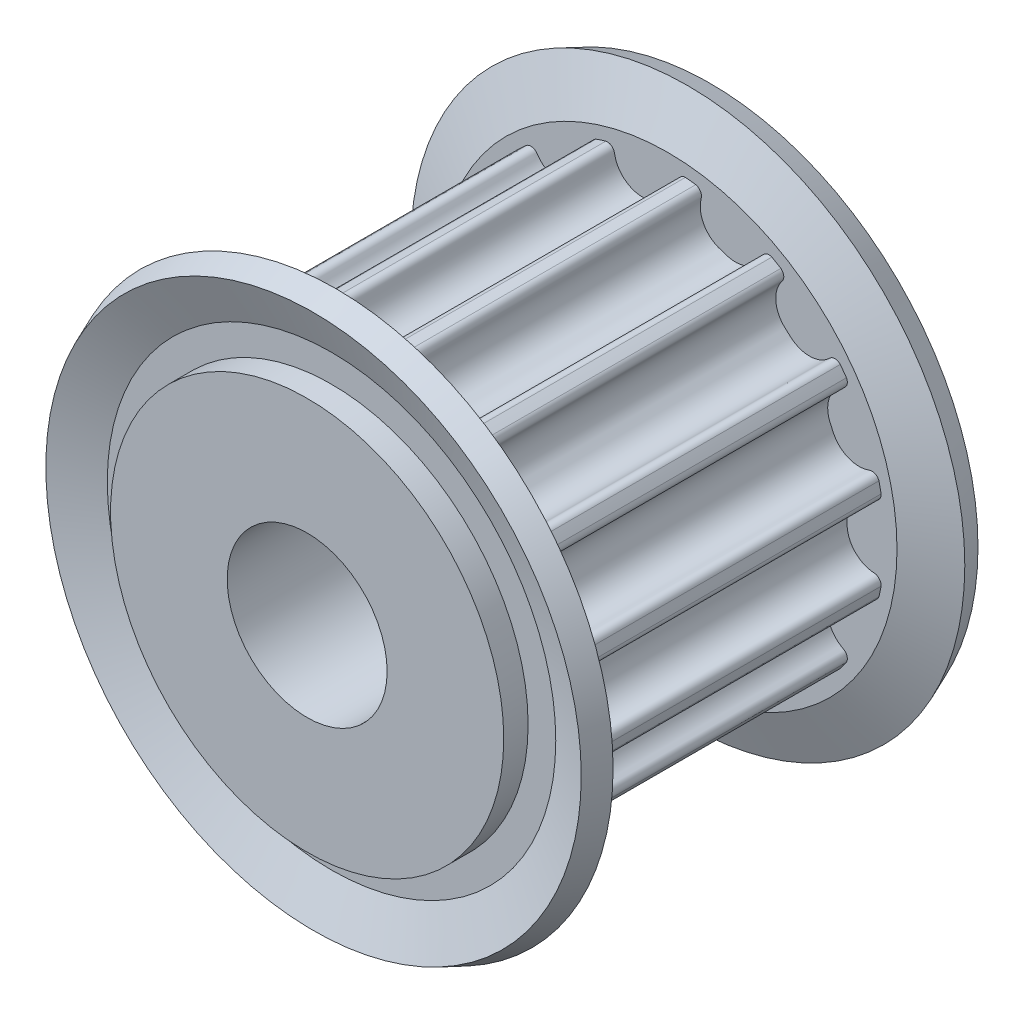
from build123d import *

# Parameters (mm, degrees)
TOOTHEXTRUDECUTGEARBELT01_DEPTH = 4.876799927
PATTERNGEARBELT01_COUNT         = 15
BOREREVOLVESKETCH_W             = 12.801599808
BOREREVOLVESKETCH_H             = 2.5


with BuildPart() as part:
    # SketchRevolveGearBelt01 → GearBelt01 (revolve)
    with BuildSketch(Plane(origin=(0, 0, 0), x_dir=(0, 0, -1), z_dir=(1, 0, 0))):
        Polygon((6.400799904, 0), (6.400799904, 6.145458216), (5.638799915, 6.145458216), (5.638799915, 7.009886979), (6.201536555, 8.368453407), (5.497540362, 8.660058178), (4.876799927, 7.161458201), (4.876799927, 6.780458207), (-4.876799927, 6.780458207), (-4.876799927, 7.161458201), (-5.497540362, 8.660058178), (-6.201536555, 8.368453407), (-5.638799915, 7.009886979), (-5.638799915, 6.145458216), (-6.400799904, 6.145458216), (-6.400799904, 0), align=None)
    revolve(axis=Axis((0, 0, 0), (0, 0, -1)))

    # SketchToothGearBelt01 → ToothExtrudeCutGearBelt01 (cut, symmetric)
    with BuildSketch(Plane.XY):
        with BuildLine():
            ThreePointArc((6.661096355, 1.272831888), (6.78161527, 0), (6.661096355, -1.272831888))
            add(Edge.make_bspline(
                [(6.661096355, -1.272831888), (6.663615018, -1.259659662), (6.665647801, -1.239568599), (6.664820876, -1.212733988), (6.662437583, -1.192740045), (6.658309361, -1.173032278), (6.652468102, -1.15376267), (6.644958835, -1.135079815), (6.635839471, -1.117127785), (6.625180333, -1.100045019), (6.613063619, -1.083963244), (6.599582765, -1.06900649), (6.584841733, -1.055290043), (6.568954182, -1.042919864), (6.552042687, -1.031990656), (6.534237438, -1.022589264), (6.515676569, -1.014778616), (6.49650012, -1.00865466), (6.476867505, -1.00413133), (6.427750984, -0.998255219), (6.361870769, -0.993498048), (6.280955314, -0.976758348), (6.213857662, -0.957771629), (6.148468462, -0.93346319), (6.085179943, -0.904141421), (6.024383488, -0.869943856), (5.966451939, -0.831092016), (5.9117414, -0.787821543), (5.860587957, -0.740399103), (5.813305895, -0.689115832), (5.770185727, -0.634286865), (5.731492294, -0.576249049), (5.697463629, -0.515358957), (5.668307661, -0.451990704), (5.644207759, -0.386533555), (5.625296172, -0.319389892), (5.611748114, -0.250971402), (5.603426544, -0.18170154), (5.601350103, -0.116556682), (5.601805881, -0.056000917), (5.601665396, 0), (5.601805881, 0.056000917), (5.601350103, 0.116556682), (5.603426544, 0.18170154), (5.611748114, 0.250971402), (5.625296172, 0.319389892), (5.644207759, 0.386533555), (5.668307661, 0.451990704), (5.697463629, 0.515358957), (5.731492294, 0.576249049), (5.770185727, 0.634286865), (5.813305895, 0.689115832), (5.860587957, 0.740399103), (5.9117414, 0.787821543), (5.966451939, 0.831092016), (6.024383488, 0.869943856), (6.085179943, 0.904141421), (6.148468462, 0.93346319), (6.213857662, 0.957771629), (6.280955314, 0.976758348), (6.361870769, 0.993498048), (6.427750984, 0.998255219), (6.476867505, 1.00413133), (6.49650012, 1.00865466), (6.515676569, 1.014778616), (6.534237438, 1.022589264), (6.552042687, 1.031990656), (6.568954182, 1.042919864), (6.584841733, 1.055290043), (6.599582765, 1.06900649), (6.613063619, 1.083963244), (6.625180333, 1.100045019), (6.635839471, 1.117127785), (6.644958835, 1.135079815), (6.652468102, 1.15376267), (6.658309361, 1.173032278), (6.662437583, 1.192740045), (6.664820876, 1.212733988), (6.665647801, 1.239568599), (6.663615018, 1.259659662), (6.661096355, 1.272831888)],
                knots=[0, 0, 0, 0, 0.010832325, 0.016248488, 0.021664651, 0.027080813, 0.032496976, 0.037913139, 0.043329302, 0.048745464, 0.054161627, 0.05957779, 0.064993952, 0.070410115, 0.075826278, 0.08124244, 0.086658603, 0.092074766, 0.097490929, 0.102907091, 0.132017291, 0.150784932, 0.169552572, 0.188320213, 0.207087853, 0.225855493, 0.244623134, 0.263390774, 0.282158415, 0.300926055, 0.319693695, 0.338461336, 0.357228976, 0.375996617, 0.394764257, 0.413531897, 0.432299538, 0.451067178, 0.469834819, 0.484917409, 0.5, 0.515082591, 0.530165181, 0.548932822, 0.567700462, 0.586468103, 0.605235743, 0.624003383, 0.642771024, 0.661538664, 0.680306305, 0.699073945, 0.717841585, 0.736609226, 0.755376866, 0.774144507, 0.792912147, 0.811679787, 0.830447428, 0.849215068, 0.867982709, 0.897092909, 0.902509071, 0.907925234, 0.913341397, 0.91875756, 0.924173722, 0.929589885, 0.935006048, 0.94042221, 0.945838373, 0.951254536, 0.956670698, 0.962086861, 0.967503024, 0.972919187, 0.978335349, 0.983751512, 0.989167675, 1, 1, 1, 1], degree=3))
        make_face()
    toothextrudecutgearbelt01 = extrude(amount=TOOTHEXTRUDECUTGEARBELT01_DEPTH, both=True, mode=Mode.SUBTRACT)

    # PatternGearBelt01: ToothExtrudeCutGearBelt01 ×15 about axis
    patterngearbelt01_axis = Axis((0, 0, 55), (0, 0, -1))
    for i in range(1, PATTERNGEARBELT01_COUNT):
        add(toothextrudecutgearbelt01.rotate(patterngearbelt01_axis, i * 360 / PATTERNGEARBELT01_COUNT), mode=Mode.SUBTRACT)

    # BoreRevolveSketch → BoreRevolveCut (revolve, cut)
    with BuildSketch(Plane(origin=(0, 0, 0), x_dir=(0, 0, -1), z_dir=(1, 0, 0))):
        with Locations((0, 1.25)):
            Rectangle(BOREREVOLVESKETCH_W, BOREREVOLVESKETCH_H)
    revolve(axis=Axis((0, 0, 0), (0, 0, -1)), mode=Mode.SUBTRACT)


solid = part.part
